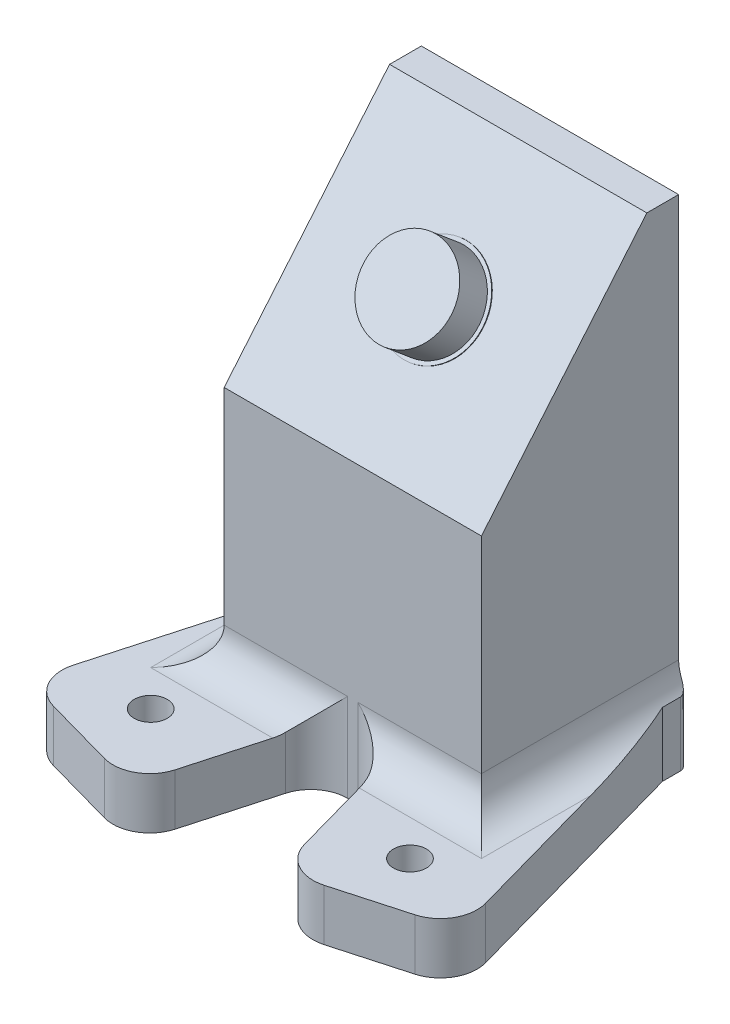
from build123d import *

# Parameters (mm, degrees)
AUFSATZ_LINEAR_AUSTRAGEN1_DEPTH = 35
SKIZZE3_R                       = 6
AUFSATZ_LINEAR_AUSTRAGEN2_DEPTH = 5
SKIZZE4_R                       = 6.5
AUFSATZ_LINEAR_AUSTRAGEN3_DEPTH = 0.1
SKIZZE9_R                       = 1.425
SCHNITT_LINEAR_AUSTRAGEN2_DEPTH = 10
SKIZZE10_R                      = 2.25
AUFSATZ_LINEAR_AUSTRAGEN4_DEPTH = 7
VERRUNDUNG1_R                   = 5
VERRUNDUNG2_R                   = 1


with BuildPart() as part:
    # Skizze1 → Aufsatz-Linear austragen1 (new body)
    with BuildSketch(Plane(origin=(0, 0, 0), x_dir=(0, 0, -1), z_dir=(1, 0, 0))):
        Polygon((0, 0), (22.497566339, 0), (26.82, 0), (26.82, 66.811555509), (22.497566339, 66.811555509), (0, 40), align=None)
    extrude(amount=AUFSATZ_LINEAR_AUSTRAGEN1_DEPTH)

    # Skizze3 → Aufsatz-Linear austragen2 (add)
    with BuildSketch(Plane(origin=(0, 16.527036447, 19.69615506), x_dir=(1, 0, 0), z_dir=(0, 0.6427876096865378, 0.7660444431189795))):
        with Locations(Location((17.5, 48.141777725, 0), (0, 0, 90))):
            Circle(SKIZZE3_R)
    extrude(amount=AUFSATZ_LINEAR_AUSTRAGEN2_DEPTH)

    # Skizze4 → Aufsatz-Linear austragen3 (add)
    with BuildSketch(Plane(origin=(0, 16.527036447, 19.69615506), x_dir=(1, 0, 0), z_dir=(0, 0.6427876096865378, 0.7660444431189795))):
        with Locations(Location((17.5, 48.141777725, 0), (0, 0, 90))):
            Circle(SKIZZE4_R)
    extrude(amount=AUFSATZ_LINEAR_AUSTRAGEN3_DEPTH)

    # Skizze9 → Schnitt-Linear austragen2 (cut)
    with BuildSketch(Plane.XZ):
        with Locations(Location((17.498844944, -21.644236877, 0), (0, 0, 270))):
            Circle(SKIZZE9_R)
    extrude(amount=-SCHNITT_LINEAR_AUSTRAGEN2_DEPTH, mode=Mode.SUBTRACT)

    # Skizze10 → Aufsatz-Linear austragen4 (add)
    # profile 1 of 2: a face of its own
    with BuildSketch(Plane.XZ):
        Polygon((35, -26.82), (36.222689888, -26.82), (36.222689888, -23.396698607), (46.898151193, 14.806878364), (27.636053566, 20.189405189), (21.994403466, 0), align=None)
        with Locations(Location((35.132608407, 9.859567437, 0), (0, 0, 270))):
            Circle(SKIZZE10_R, mode=Mode.SUBTRACT)
    # profile 2 of 2: a face of its own
    with BuildSketch(Plane.XZ):
        Polygon((-1.222689888, -26.82), (-1.222689888, -23.396698607), (-11.898151193, 14.806878364), (7.363946434, 20.189405189), (13.005596534, 0), (0, -26.82), align=None)
        with Locations(Location((-0.132608407, 9.859567437, 0), (0, 0, 90))):
            Circle(SKIZZE10_R, mode=Mode.SUBTRACT)
    extrude(amount=-AUFSATZ_LINEAR_AUSTRAGEN4_DEPTH)

    # Verrundung1
    verrundung1_edges = [part.edges().sort_by_distance(p)[0] for p in [
        (6.502798267, 7, 0),
        (28.497201733, 7, 0),
        (35, 7, -13.41),
        (0, 7, -13.41),
        (-11.898151193, 3.5, 14.806878364),
        (7.363946434, 3.5, 20.189405189),
        (46.898151193, 3.5, 14.806878364),
        (27.636053566, 3.5, 20.189405189),
        (21.994403466, 3.5, 0),
        (13.005596534, 3.5, 0),
    ]]
    fillet(verrundung1_edges, radius=VERRUNDUNG1_R)

    # Verrundung2
    verrundung2_edges = [part.edges().sort_by_distance(p)[0] for p in [
        (36.222689888, 4.362018901, -26.82),
        (-1.222689888, 4.362018901, -26.82),
    ]]
    fillet(verrundung2_edges, radius=VERRUNDUNG2_R)


solid = part.part
